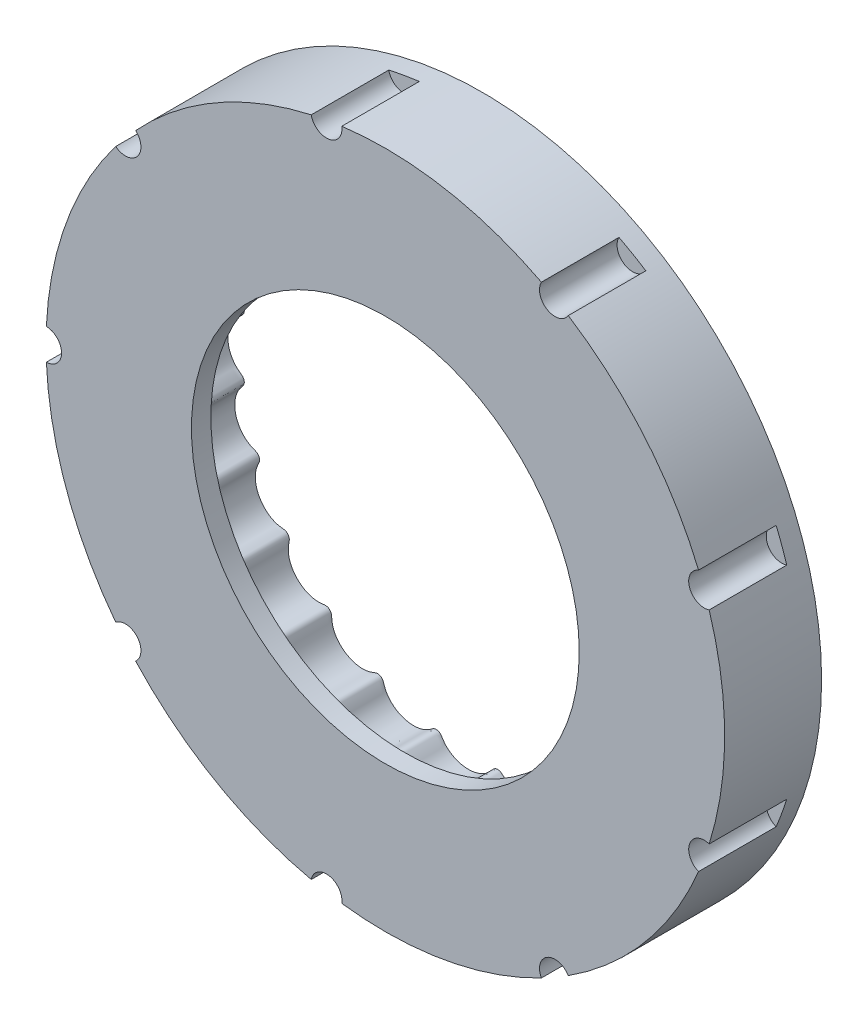
from build123d import *

# Parameters (mm, degrees)
ESQUISSE1_R             = 35
BOSS_EXTRU_1_DEPTH      = 8
ESQUISSE3_R             = 35
ESQUISSE3_R_2           = 20
BOSS_EXTRU_2_DEPTH      = 2
ESQUISSE4_R             = 1.6
ENL_V_MAT_EXTRU_2_DEPTH = 8


with BuildPart() as part:
    # Esquisse1 → Boss.-Extru.1 (new body)
    with BuildSketch(Plane.XY):
        Circle(ESQUISSE1_R)
        with BuildLine():
            add(Edge.make_bspline(
                [(24.75, 0), (24.75, -0.01190895), (24.750668659, -0.029768799), (24.75289752, -0.060006713), (24.758884934, -0.104774168), (24.767485304, -0.1467503), (24.785152354, -0.206071411), (24.818482478, -0.284185867), (24.880818803, -0.385919884), (24.984658612, -0.50047292), (25.114781066, -0.616600782), (25.255435339, -0.752464933), (25.419807145, -0.93333087), (25.594989864, -1.169106201), (25.768920192, -1.472936072), (25.920736133, -1.849650866), (26.023477253, -2.249860974), (26.074696747, -2.666946621), (26.073312156, -3.086313852), (26.020370658, -3.501501101), (25.917002683, -3.906273732), (25.764403676, -4.294347485), (25.566224565, -4.654785317), (25.325903213, -4.981499954), (25.081588671, -5.233067427), (24.851914535, -5.418631885), (24.667098284, -5.540217829), (24.539548747, -5.613941762), (24.410179088, -5.684594723), (24.273991814, -5.758046627), (24.120002912, -5.867762768), (23.989867, -6.050335584), (23.936355638, -6.275127193), (23.969192195, -6.495758333), (24.065351302, -6.684284012), (24.178449314, -6.851934675), (24.280144364, -7.019011908), (24.393570042, -7.235347013), (24.503436737, -7.50770452), (24.595094748, -7.84543671), (24.647032867, -8.248159789), (24.645694803, -8.661209862), (24.57595365, -9.185528563), (24.417645445, -9.696077248), (24.174741138, -10.176578568), (23.852030812, -10.610062282), (23.558837347, -10.90980476), (23.24095056, -11.157802847), (22.946586259, -11.329086722), (22.692113519, -11.440823192), (22.472657763, -11.513539342), (22.29388462, -11.561503733), (22.101259895, -11.606028638), (21.902055354, -11.681610724), (21.728453668, -11.828148656), (21.620885016, -12.038837081), (21.601595838, -12.263660858), (21.650481834, -12.469316746), (21.718254479, -12.659791435), (21.774584138, -12.84705718), (21.829677768, -13.084963879), (21.867201208, -13.376160202), (21.870688906, -13.725995236), (21.819474916, -14.128698884), (21.71419458, -14.527993453), (21.514773646, -15.017801417), (21.233133123, -15.4720736), (20.877140734, -15.876030958), (20.455657215, -16.214386724), (20.096354081, -16.430676116), (19.726170583, -16.590569736), (19.398076252, -16.68206281), (19.123633935, -16.725922166), (18.892914818, -16.74091163), (18.707848134, -16.742350192), (18.510091067, -16.737829569), (18.298399992, -16.764443666), (18.095471353, -16.866909122), (17.942147178, -17.047179332), (17.871387572, -17.261366287), (17.870202468, -17.472525416), (17.888313355, -17.673814374), (17.895669209, -17.869207586), (17.888886536, -18.113260777), (17.85168272, -18.404436203), (17.766823301, -18.743754438), (17.615819616, -19.120463832), (17.413434594, -19.48028858), (17.162321288, -19.816819375), (16.868500143, -20.122110223), (16.535786091, -20.390797243), (16.168397966, -20.617282366), (15.771042449, -20.795687849), (15.368766607, -20.914546396), (14.97017149, -20.975982916), (14.629556137, -20.981746846), (14.352921577, -20.954877105), (14.125857036, -20.911170138), (13.94640051, -20.866001244), (13.755772511, -20.812781493), (13.543469889, -20.788894817), (13.322238716, -20.84166807), (13.131407642, -20.981742865), (13.0130413, -21.173627181), (12.961818542, -21.378246364), (12.929064797, -21.57761534), (12.886990745, -21.768547341), (12.818791692, -22.002934942), (12.70930802, -22.275243379), (12.541628211, -22.582120244), (12.300626204, -22.908551746), (12.01422203, -23.205749325), (11.686582401, -23.4681837), (11.325453487, -23.689705246), (10.935854532, -23.866053147), (10.523258626, -23.992837457), (10.093696991, -24.06550579), (9.674368845, -24.079231972), (9.273085465, -24.038208914), (8.941983123, -23.957846351), (8.681067639, -23.861969077), (8.472360468, -23.762392874), (8.310008249, -23.673519219), (8.138322101, -23.574972467), (7.937182673, -23.501849574), (7.704899941, -23.502076627), (7.478095746, -23.600741865), (7.316947907, -23.77285878), (7.220831609, -23.97055906), (7.115634845, -24.203403783), (6.974300377, -24.460401189), (6.773045478, -24.737487424), (6.497851462, -25.02237666), (6.183428844, -25.270910892), (5.835740341, -25.479668636), (5.460328709, -25.645214949), (5.061542815, -25.765601822), (4.644666369, -25.83709061), (4.215744672, -25.855893135), (3.781608585, -25.818103671), (3.372294549, -25.725760832), (2.994169108, -25.584908149), (2.694109042, -25.423555897), (2.465647641, -25.264915254), (2.289085947, -25.115815571), (2.153739497, -24.989104422), (2.012318186, -24.851122457), (1.832423714, -24.733108156), (1.552983355, -24.66593755), (1.26214529, -24.754622086), (1.075414287, -24.957557798), (0.889090341, -25.194134228), (0.69672049, -25.401829912), (0.44758856, -25.61527269), (0.125683965, -25.821812182), (-0.224585626, -25.987068298), (-0.598975616, -26.109092558), (-0.990876156, -26.185347308), (-1.391941275, -26.2145582), (-1.796224618, -26.195837186), (-2.198144681, -26.128499562), (-2.591457519, -26.011923113), (-2.962803429, -25.848997421), (-3.306221845, -25.642423994), (-3.61537583, -25.39483403), (-3.850272783, -25.145621471), (-4.023133112, -24.908691884), (-4.156981332, -24.691054937), (-4.276293257, -24.506578487), (-4.456318725, -24.354528199), (-4.693068775, -24.282897531), (-4.923798246, -24.309710303), (-5.115035952, -24.406102337), (-5.273240645, -24.525178417), (-5.42301226, -24.633920894), (-5.617383402, -24.75923363), (-5.863981708, -24.887558689), (-6.182207181, -25.009385657), (-6.575059912, -25.101071531), (-6.9927825, -25.140689035), (-7.428136381, -25.123106217), (-7.851204623, -25.050059218), (-8.255644199, -24.926289526), (-8.635975215, -24.756290763), (-8.987390026, -24.544434268), (-9.305810055, -24.293211507), (-9.586131065, -24.006734367), (-9.822904508, -23.689158592), (-9.987239236, -23.388704672), (-10.094751199, -23.11580793), (-10.169610451, -22.871508954), (-10.24112571, -22.663502872), (-10.381175345, -22.473662137), (-10.594956363, -22.349311543), (-10.825624608, -22.322047042), (-11.033849204, -22.370890621), (-11.216381876, -22.447371753), (-11.388695767, -22.514940651), (-11.608352834, -22.58716666), (-11.87933894, -22.649041617), (-12.217942215, -22.68664221), (-12.621151131, -22.6763477), (-13.035301253, -22.609509201), (-13.452127793, -22.482943679), (-13.845292771, -22.304868342), (-14.20938889, -22.080540487), (-14.539531306, -21.814993299), (-14.831269767, -21.513076759), (-15.077661765, -21.181891436), (-15.275270226, -20.827454377), (-15.402577207, -20.501715906), (-15.476526159, -20.217667398), (-15.514326563, -19.976485954), (-15.531829272, -19.781749163), (-15.539202372, -19.579813227), (-15.565591069, -19.370421028), (-15.660806856, -19.1659885), (-15.83405536, -19.004717982), (-16.047591105, -18.926560558), (-16.261088064, -18.925182163), (-16.456798489, -18.954287053), (-16.640543184, -18.976331541), (-16.871307425, -18.990807395), (-17.149104778, -18.982241272), (-17.486194881, -18.933211709), (-17.873723074, -18.821638459), (-18.257615968, -18.652692803), (-18.629084532, -18.425342732), (-18.964764813, -18.15411038), (-19.260725449, -17.845401443), (-19.513475385, -17.50529118), (-19.719894943, -17.139574851), (-19.874988153, -16.756923442), (-19.976929286, -16.364037242), (-20.017953734, -16.016642642), (-20.017798024, -15.723070973), (-19.993447495, -15.480115157), (-19.96134753, -15.287225434), (-19.918054975, -15.089779832), (-19.89402871, -14.879875268), (-19.939362883, -14.658860507), (-20.070693635, -14.462043286), (-20.260249499, -14.336679591), (-20.467155514, -14.285214031), (-20.663881817, -14.2650629), (-20.847282484, -14.240161779), (-21.074211831, -14.195950386), (-21.340836688, -14.11751373), (-21.654611423, -13.985047804), (-22.001454707, -13.779432555), (-22.330360371, -13.519308084), (-22.705485211, -13.130240844), (-23.007369545, -12.684411231), (-23.229136266, -12.198075036), (-23.364819327, -11.686883469), (-23.418570267, -11.277399868), (-23.418213213, -10.871399708), (-23.370257339, -10.524800668), (-23.295965049, -10.240716159), (-23.211017087, -10.011726748), (-23.131365089, -9.833119484), (-23.040198426, -9.652618084), (-22.96715924, -9.454144986), (-22.960141523, -9.228680333), (-23.042373084, -9.007208297), (-23.198166311, -8.840665724), (-23.388940312, -8.741382585), (-23.57769294, -8.6722803), (-23.75308195, -8.599853942), (-23.966244513, -8.496298837), (-24.209343816, -8.347711506), (-24.48032477, -8.1355972), (-24.761295108, -7.846344695), (-25.008480075, -7.513349868), (-25.26655565, -7.04900195), (-25.442920247, -6.54763643), (-25.533949151, -6.025561479), (-25.536599067, -5.498854498), (-25.485486947, -5.088916426), (-25.382794666, -4.696000106), (-25.248906316, -4.372612425), (-25.105242941, -4.116427211), (-24.965170858, -3.916248887), (-24.843083512, -3.763442502), (-24.709834093, -3.611215538), (-24.591948067, -3.435387495), (-24.533798882, -3.220620895), (-24.560423715, -2.992589013), (-24.66665443, -2.797016304), (-24.822727104, -2.653701408), (-24.98966356, -2.53926073), (-25.146322188, -2.422077132), (-25.332496393, -2.263776399), (-25.502275925, -2.087254142), (-25.654526877, -1.895838833), (-25.79052351, -1.688263992), (-25.890012472, -1.511998867), (-25.978955887, -1.325507929), (-26.056614781, -1.131467198), (-26.121383307, -0.930707527), (-26.173241314, -0.729759288), (-26.207287779, -0.545661218), (-26.228372118, -0.39585777), (-26.240536879, -0.255725402), (-26.247025958, -0.16909655), (-26.249459241, -0.066739393), (-26.25, -0.022255367), (-26.25, 0)],
                knots=[0.07432085, 0.07432085, 0.07432085, 0.07432085, 0.07432085, 0.074838236, 0.075096929, 0.075355622, 0.075873009, 0.076390395, 0.077425167, 0.07845994, 0.080262761, 0.082065582, 0.083868403, 0.085671224, 0.089276866, 0.092882508, 0.096749545, 0.100616583, 0.104483621, 0.108350658, 0.112188336, 0.116026013, 0.11986369, 0.123701367, 0.12732655, 0.130951733, 0.132764324, 0.134576916, 0.135483211, 0.136389507, 0.138202099, 0.140295775, 0.142389451, 0.144458848, 0.146528245, 0.148330503, 0.150132762, 0.15193502, 0.153737278, 0.157341795, 0.160946311, 0.164812321, 0.16867833, 0.17254434, 0.180415799, 0.184421248, 0.188426697, 0.192432147, 0.195844027, 0.199255907, 0.200961848, 0.202667788, 0.204373728, 0.206079668, 0.208268892, 0.210458115, 0.21252702, 0.214595925, 0.216397713, 0.218199501, 0.220001289, 0.221803077, 0.225406654, 0.22901023, 0.232875219, 0.236740209, 0.240605199, 0.248476586, 0.252482983, 0.25648938, 0.260495777, 0.263907756, 0.267319735, 0.269025725, 0.270731714, 0.272437704, 0.274143693, 0.276335152, 0.278526612, 0.280594702, 0.282662792, 0.284464203, 0.286265613, 0.288067024, 0.289868435, 0.293471257, 0.297074079, 0.300938067, 0.304802055, 0.308666044, 0.312530032, 0.316537343, 0.320544653, 0.324551964, 0.328559274, 0.331971493, 0.335383713, 0.337089822, 0.338795932, 0.340502041, 0.342208151, 0.3444015, 0.346594848, 0.348661829, 0.35072881, 0.352529935, 0.354331061, 0.356132186, 0.357933311, 0.361535562, 0.365137813, 0.369000829, 0.372863844, 0.37672686, 0.380589876, 0.384598055, 0.388606234, 0.392614413, 0.396622592, 0.400035189, 0.403447785, 0.405154083, 0.406860381, 0.408566679, 0.410272977, 0.412467856, 0.414662735, 0.416905332, 0.41914793, 0.420947533, 0.422747136, 0.426346341, 0.429945547, 0.433544752, 0.437320979, 0.441097206, 0.444873433, 0.44864966, 0.452658654, 0.456667648, 0.460676642, 0.464685636, 0.468098738, 0.471511839, 0.473218389, 0.47492494, 0.476631491, 0.478338041, 0.480534086, 0.48273013, 0.487019518, 0.488748834, 0.49047815, 0.493936782, 0.497395414, 0.500854047, 0.504530334, 0.508206621, 0.511882908, 0.515559195, 0.519334982, 0.52311077, 0.526886557, 0.530662345, 0.534261527, 0.537860709, 0.541459892, 0.543259483, 0.545059074, 0.547300663, 0.549542252, 0.55173776, 0.553933267, 0.555639684, 0.5573461, 0.559052517, 0.560758933, 0.564171767, 0.5675846, 0.571593194, 0.575601788, 0.579610382, 0.583618976, 0.587395654, 0.591172332, 0.594949011, 0.598725689, 0.602324954, 0.605924219, 0.609523484, 0.611323117, 0.613122749, 0.615366313, 0.617609877, 0.619804036, 0.621998195, 0.623704391, 0.625410586, 0.627116782, 0.628822977, 0.632235368, 0.635647759, 0.63965551, 0.643663261, 0.647671012, 0.651678763, 0.655542261, 0.659405759, 0.663269257, 0.667132755, 0.670735268, 0.674337782, 0.676139039, 0.677940295, 0.679741552, 0.681542809, 0.683610379, 0.685677949, 0.687870397, 0.690062845, 0.691768886, 0.693474927, 0.695180968, 0.696887009, 0.700299091, 0.703711172, 0.707718031, 0.71172489, 0.715731748, 0.719738607, 0.723603093, 0.727467579, 0.731332066, 0.735196552, 0.738799727, 0.742402903, 0.744204491, 0.746006079, 0.747807667, 0.749609255, 0.751677791, 0.753746327, 0.755936711, 0.758127095, 0.75983305, 0.761539006, 0.763244962, 0.764950918, 0.76836283, 0.771774741, 0.775780668, 0.779786595, 0.783792522, 0.791663947, 0.795529445, 0.799394943, 0.803260441, 0.806864464, 0.810468487, 0.812270499, 0.81407251, 0.815874522, 0.817676533, 0.819745726, 0.821814919, 0.823998833, 0.826182748, 0.827931402, 0.829680057, 0.831428712, 0.833177366, 0.836674676, 0.840171985, 0.844093542, 0.8480151, 0.851936657, 0.859724738, 0.863591261, 0.867457784, 0.871324307, 0.874929364, 0.87853442, 0.880336948, 0.882139476, 0.883942004, 0.885744532, 0.887814048, 0.889883563, 0.891953048, 0.894022532, 0.895825669, 0.897628805, 0.899431941, 0.901235078, 0.90484135, 0.906644487, 0.908447623, 0.910381399, 0.912315175, 0.914248951, 0.916182727, 0.918116503, 0.920050278, 0.921017166, 0.921984054, 0.922950942, 0.92391783, 0.92391783, 0.92391783, 0.92391783, 0.92391783], degree=4))
            add(Edge.make_bspline(
                [(24.75, 0), (24.75, 0.01190895), (24.750668659, 0.029768799), (24.75289752, 0.060006713), (24.758884934, 0.104774168), (24.767485304, 0.1467503), (24.785152354, 0.206071411), (24.818482478, 0.284185867), (24.880818803, 0.385919884), (24.984658612, 0.50047292), (25.114781066, 0.616600782), (25.255435339, 0.752464933), (25.419807145, 0.93333087), (25.594989864, 1.169106201), (25.768920192, 1.472936072), (25.920736133, 1.849650866), (26.023477253, 2.249860974), (26.074696747, 2.666946621), (26.073312156, 3.086313852), (26.020370658, 3.501501101), (25.917002683, 3.906273732), (25.764403676, 4.294347485), (25.566224565, 4.654785317), (25.325903213, 4.981499954), (25.081588671, 5.233067427), (24.851914535, 5.418631885), (24.667098284, 5.540217829), (24.539548747, 5.613941762), (24.410179088, 5.684594723), (24.273991814, 5.758046627), (24.120002912, 5.867762768), (23.989867, 6.050335584), (23.936355638, 6.275127193), (23.969192195, 6.495758333), (24.065351302, 6.684284012), (24.178449314, 6.851934675), (24.280144364, 7.019011908), (24.393570042, 7.235347013), (24.503436737, 7.50770452), (24.595094748, 7.84543671), (24.647032867, 8.248159789), (24.645694803, 8.661209862), (24.57595365, 9.185528563), (24.417645445, 9.696077248), (24.174741138, 10.176578568), (23.852030812, 10.610062282), (23.558837347, 10.90980476), (23.24095056, 11.157802847), (22.946586259, 11.329086722), (22.692113519, 11.440823192), (22.472657763, 11.513539342), (22.29388462, 11.561503733), (22.101259895, 11.606028638), (21.902055354, 11.681610724), (21.728453668, 11.828148656), (21.620885016, 12.038837081), (21.601595838, 12.263660858), (21.650481834, 12.469316746), (21.718254479, 12.659791435), (21.774584138, 12.84705718), (21.829677768, 13.084963879), (21.867201208, 13.376160202), (21.870688906, 13.725995236), (21.819474916, 14.128698884), (21.71419458, 14.527993453), (21.514773646, 15.017801417), (21.233133123, 15.4720736), (20.877140734, 15.876030958), (20.455657215, 16.214386724), (20.096354081, 16.430676116), (19.726170583, 16.590569736), (19.398076252, 16.68206281), (19.123633935, 16.725922166), (18.892914818, 16.74091163), (18.707848134, 16.742350192), (18.510091067, 16.737829569), (18.298399992, 16.764443666), (18.095471353, 16.866909122), (17.942147178, 17.047179332), (17.871387572, 17.261366287), (17.870202468, 17.472525416), (17.888313355, 17.673814374), (17.895669209, 17.869207586), (17.888886536, 18.113260777), (17.85168272, 18.404436203), (17.766823301, 18.743754438), (17.615819616, 19.120463832), (17.413434594, 19.48028858), (17.162321288, 19.816819375), (16.868500143, 20.122110223), (16.535786091, 20.390797243), (16.168397966, 20.617282366), (15.771042449, 20.795687849), (15.368766607, 20.914546396), (14.97017149, 20.975982916), (14.629556137, 20.981746846), (14.352921577, 20.954877105), (14.125857036, 20.911170138), (13.94640051, 20.866001244), (13.755772511, 20.812781493), (13.543469889, 20.788894817), (13.322238716, 20.84166807), (13.131407642, 20.981742865), (13.0130413, 21.173627181), (12.961818542, 21.378246364), (12.929064797, 21.57761534), (12.886990745, 21.768547341), (12.818791692, 22.002934942), (12.70930802, 22.275243379), (12.541628211, 22.582120244), (12.300626204, 22.908551746), (12.01422203, 23.205749325), (11.686582401, 23.4681837), (11.325453487, 23.689705246), (10.935854532, 23.866053147), (10.523258626, 23.992837457), (10.093696991, 24.06550579), (9.674368845, 24.079231972), (9.273085465, 24.038208914), (8.941983123, 23.957846351), (8.681067639, 23.861969077), (8.472360468, 23.762392874), (8.310008249, 23.673519219), (8.138322101, 23.574972467), (7.937182673, 23.501849574), (7.704899941, 23.502076627), (7.478095746, 23.600741865), (7.316947907, 23.772858779), (7.220831609, 23.97055906), (7.115634845, 24.203403783), (6.974300377, 24.460401189), (6.773045477, 24.737487424), (6.497851462, 25.02237666), (6.183428844, 25.270910892), (5.835740341, 25.479668636), (5.460328709, 25.645214949), (5.061542815, 25.765601822), (4.644666369, 25.83709061), (4.215744672, 25.855893135), (3.781608585, 25.818103671), (3.372294549, 25.725760832), (2.994169108, 25.584908149), (2.694109042, 25.423555897), (2.465647641, 25.264915254), (2.289085947, 25.115815571), (2.153739497, 24.989104422), (2.012318186, 24.851122457), (1.832423714, 24.733108156), (1.552983354, 24.66593755), (1.26214529, 24.754622086), (1.075414287, 24.957557798), (0.889090341, 25.194134228), (0.69672049, 25.401829912), (0.44758856, 25.61527269), (0.125683965, 25.821812182), (-0.224585626, 25.987068298), (-0.598975616, 26.109092558), (-0.990876156, 26.185347308), (-1.391941275, 26.2145582), (-1.796224618, 26.195837186), (-2.198144681, 26.128499562), (-2.591457519, 26.011923113), (-2.962803429, 25.848997421), (-3.306221845, 25.642423994), (-3.61537583, 25.39483403), (-3.850272783, 25.145621471), (-4.023133112, 24.908691884), (-4.156981332, 24.691054937), (-4.276293257, 24.506578487), (-4.456318725, 24.354528199), (-4.693068775, 24.282897531), (-4.923798246, 24.309710303), (-5.115035952, 24.406102337), (-5.273240646, 24.525178417), (-5.42301226, 24.633920894), (-5.617383402, 24.75923363), (-5.863981708, 24.887558689), (-6.182207181, 25.009385657), (-6.575059912, 25.101071531), (-6.9927825, 25.140689035), (-7.428136381, 25.123106217), (-7.851204623, 25.050059218), (-8.255644199, 24.926289526), (-8.635975215, 24.756290763), (-8.987390026, 24.544434268), (-9.305810055, 24.293211507), (-9.586131065, 24.006734367), (-9.822904508, 23.689158592), (-9.987239236, 23.388704672), (-10.094751199, 23.11580793), (-10.169610451, 22.871508954), (-10.24112571, 22.663502872), (-10.381175345, 22.473662137), (-10.594956363, 22.349311543), (-10.825624608, 22.322047042), (-11.033849204, 22.370890621), (-11.216381876, 22.447371753), (-11.388695767, 22.514940651), (-11.608352834, 22.58716666), (-11.87933894, 22.649041617), (-12.217942215, 22.68664221), (-12.621151131, 22.676347699), (-13.035301253, 22.609509201), (-13.452127793, 22.482943679), (-13.845292771, 22.304868342), (-14.20938889, 22.080540487), (-14.539531306, 21.814993299), (-14.831269767, 21.513076759), (-15.077661765, 21.181891436), (-15.275270226, 20.827454377), (-15.402577207, 20.501715906), (-15.476526159, 20.217667398), (-15.514326563, 19.976485954), (-15.531829272, 19.781749163), (-15.539202372, 19.579813227), (-15.565591069, 19.370421028), (-15.660806856, 19.1659885), (-15.83405536, 19.004717982), (-16.047591105, 18.926560558), (-16.261088064, 18.925182163), (-16.456798489, 18.954287053), (-16.640543184, 18.976331541), (-16.871307425, 18.990807395), (-17.149104778, 18.982241272), (-17.486194881, 18.933211709), (-17.873723074, 18.821638459), (-18.257615968, 18.652692802), (-18.629084532, 18.425342732), (-18.964764813, 18.15411038), (-19.260725449, 17.845401443), (-19.513475385, 17.50529118), (-19.719894943, 17.139574851), (-19.874988153, 16.756923442), (-19.976929286, 16.364037242), (-20.017953734, 16.016642642), (-20.017798024, 15.723070973), (-19.993447495, 15.480115157), (-19.96134753, 15.287225434), (-19.918054975, 15.089779832), (-19.89402871, 14.879875268), (-19.939362883, 14.658860507), (-20.070693635, 14.462043286), (-20.260249499, 14.336679591), (-20.467155514, 14.285214031), (-20.663881817, 14.2650629), (-20.847282484, 14.240161779), (-21.074211831, 14.195950386), (-21.340836688, 14.11751373), (-21.654611423, 13.985047804), (-22.001454707, 13.779432555), (-22.330360371, 13.519308084), (-22.705485211, 13.130240844), (-23.007369545, 12.684411231), (-23.229136266, 12.198075036), (-23.364819327, 11.686883469), (-23.418570267, 11.277399868), (-23.418213213, 10.871399708), (-23.370257339, 10.524800667), (-23.295965049, 10.240716159), (-23.211017087, 10.011726748), (-23.131365089, 9.833119484), (-23.040198426, 9.652618084), (-22.96715924, 9.454144986), (-22.960141523, 9.228680333), (-23.042373084, 9.007208297), (-23.198166311, 8.840665724), (-23.388940312, 8.741382585), (-23.57769294, 8.6722803), (-23.75308195, 8.599853942), (-23.966244513, 8.496298837), (-24.209343816, 8.347711506), (-24.48032477, 8.1355972), (-24.761295108, 7.846344695), (-25.008480075, 7.513349868), (-25.26655565, 7.04900195), (-25.442920247, 6.54763643), (-25.533949151, 6.025561479), (-25.536599067, 5.498854498), (-25.485486947, 5.088916426), (-25.382794666, 4.696000106), (-25.248906316, 4.372612425), (-25.105242941, 4.116427211), (-24.965170858, 3.916248887), (-24.843083512, 3.763442502), (-24.709834093, 3.611215538), (-24.591948067, 3.435387495), (-24.533798882, 3.220620895), (-24.560423715, 2.992589013), (-24.66665443, 2.797016303), (-24.822727104, 2.653701408), (-24.98966356, 2.53926073), (-25.146322188, 2.422077132), (-25.332496393, 2.263776399), (-25.502275925, 2.087254142), (-25.654526877, 1.895838833), (-25.79052351, 1.688263992), (-25.890012472, 1.511998867), (-25.978955887, 1.325507929), (-26.056614781, 1.131467198), (-26.121383307, 0.930707527), (-26.173241314, 0.729759288), (-26.207287779, 0.545661218), (-26.228372118, 0.39585777), (-26.240536879, 0.255725402), (-26.247025958, 0.16909655), (-26.249459241, 0.066739393), (-26.25, 0.022255367), (-26.25, 0)],
                knots=[0.07432085, 0.07432085, 0.07432085, 0.07432085, 0.07432085, 0.074838236, 0.075096929, 0.075355622, 0.075873009, 0.076390395, 0.077425167, 0.07845994, 0.080262761, 0.082065582, 0.083868403, 0.085671224, 0.089276866, 0.092882508, 0.096749545, 0.100616583, 0.104483621, 0.108350658, 0.112188336, 0.116026013, 0.11986369, 0.123701367, 0.12732655, 0.130951733, 0.132764324, 0.134576916, 0.135483211, 0.136389507, 0.138202099, 0.140295775, 0.142389451, 0.144458848, 0.146528245, 0.148330503, 0.150132762, 0.15193502, 0.153737278, 0.157341795, 0.160946311, 0.164812321, 0.16867833, 0.17254434, 0.180415799, 0.184421248, 0.188426697, 0.192432147, 0.195844027, 0.199255907, 0.200961848, 0.202667788, 0.204373728, 0.206079668, 0.208268892, 0.210458115, 0.21252702, 0.214595925, 0.216397713, 0.218199501, 0.220001289, 0.221803077, 0.225406654, 0.22901023, 0.232875219, 0.236740209, 0.240605199, 0.248476586, 0.252482983, 0.25648938, 0.260495777, 0.263907756, 0.267319735, 0.269025725, 0.270731714, 0.272437704, 0.274143693, 0.276335152, 0.278526612, 0.280594702, 0.282662792, 0.284464203, 0.286265613, 0.288067024, 0.289868435, 0.293471257, 0.297074079, 0.300938067, 0.304802055, 0.308666044, 0.312530032, 0.316537343, 0.320544653, 0.324551964, 0.328559274, 0.331971493, 0.335383713, 0.337089822, 0.338795932, 0.340502041, 0.342208151, 0.3444015, 0.346594848, 0.348661829, 0.35072881, 0.352529935, 0.354331061, 0.356132186, 0.357933311, 0.361535562, 0.365137813, 0.369000829, 0.372863844, 0.37672686, 0.380589876, 0.384598055, 0.388606234, 0.392614413, 0.396622592, 0.400035189, 0.403447785, 0.405154083, 0.406860381, 0.408566679, 0.410272977, 0.412467856, 0.414662735, 0.416905332, 0.41914793, 0.420947533, 0.422747136, 0.426346341, 0.429945547, 0.433544752, 0.437320979, 0.441097206, 0.444873433, 0.44864966, 0.452658654, 0.456667648, 0.460676642, 0.464685636, 0.468098738, 0.471511839, 0.473218389, 0.47492494, 0.476631491, 0.478338041, 0.480534086, 0.48273013, 0.487019518, 0.488748834, 0.49047815, 0.493936782, 0.497395414, 0.500854047, 0.504530334, 0.508206621, 0.511882908, 0.515559195, 0.519334982, 0.52311077, 0.526886557, 0.530662345, 0.534261527, 0.537860709, 0.541459892, 0.543259483, 0.545059074, 0.547300663, 0.549542252, 0.55173776, 0.553933267, 0.555639684, 0.5573461, 0.559052517, 0.560758933, 0.564171767, 0.5675846, 0.571593194, 0.575601788, 0.579610382, 0.583618976, 0.587395654, 0.591172332, 0.594949011, 0.598725689, 0.602324954, 0.605924219, 0.609523484, 0.611323117, 0.613122749, 0.615366313, 0.617609877, 0.619804036, 0.621998195, 0.623704391, 0.625410586, 0.627116782, 0.628822977, 0.632235368, 0.635647759, 0.63965551, 0.643663261, 0.647671012, 0.651678763, 0.655542261, 0.659405759, 0.663269257, 0.667132755, 0.670735268, 0.674337782, 0.676139039, 0.677940295, 0.679741552, 0.681542809, 0.683610379, 0.685677949, 0.687870397, 0.690062845, 0.691768886, 0.693474927, 0.695180968, 0.696887009, 0.700299091, 0.703711172, 0.707718031, 0.71172489, 0.715731748, 0.719738607, 0.723603093, 0.727467579, 0.731332066, 0.735196552, 0.738799727, 0.742402903, 0.744204491, 0.746006079, 0.747807667, 0.749609255, 0.751677791, 0.753746327, 0.755936711, 0.758127095, 0.75983305, 0.761539006, 0.763244962, 0.764950918, 0.76836283, 0.771774741, 0.775780668, 0.779786595, 0.783792522, 0.791663947, 0.795529445, 0.799394943, 0.803260441, 0.806864464, 0.810468487, 0.812270499, 0.81407251, 0.815874522, 0.817676533, 0.819745726, 0.821814919, 0.823998833, 0.826182748, 0.827931402, 0.829680057, 0.831428712, 0.833177366, 0.836674676, 0.840171985, 0.844093542, 0.8480151, 0.851936657, 0.859724738, 0.863591261, 0.867457784, 0.871324307, 0.874929364, 0.87853442, 0.880336948, 0.882139476, 0.883942004, 0.885744532, 0.887814048, 0.889883563, 0.891953048, 0.894022532, 0.895825669, 0.897628805, 0.899431941, 0.901235078, 0.90484135, 0.906644487, 0.908447623, 0.910381399, 0.912315175, 0.914248951, 0.916182727, 0.918116503, 0.920050278, 0.921017166, 0.921984054, 0.922950942, 0.92391783, 0.92391783, 0.92391783, 0.92391783, 0.92391783], degree=4))
        make_face(mode=Mode.SUBTRACT)
    extrude(amount=BOSS_EXTRU_1_DEPTH)

    # Esquisse3 → Boss.-Extru.2 (add)
    with BuildSketch(Plane.XY.offset(8)):
        Circle(ESQUISSE3_R)
        Circle(ESQUISSE3_R_2, mode=Mode.SUBTRACT)
    extrude(amount=BOSS_EXTRU_2_DEPTH)

    # Esquisse4 → Enlèv. mat.-Extru.2 (cut)
    with BuildSketch(Plane.XY.offset(10)):
        with Locations((-35, 0)):
            Circle(ESQUISSE4_R)
        with Locations((-26.811555509, 22.497566339)):
            Circle(ESQUISSE4_R)
        with Locations((-6.077686218, 34.468271355)):
            Circle(ESQUISSE4_R)
        with Locations((17.5, 30.310889132)):
            Circle(ESQUISSE4_R)
        with Locations((32.889241728, 11.970705016)):
            Circle(ESQUISSE4_R)
        with Locations((32.889241728, -11.970705016)):
            Circle(ESQUISSE4_R)
        with Locations((17.5, -30.310889132)):
            Circle(ESQUISSE4_R)
        with Locations((-6.077686218, -34.468271355)):
            Circle(ESQUISSE4_R)
        with Locations((-26.811555509, -22.497566339)):
            Circle(ESQUISSE4_R)
    extrude(amount=-ENL_V_MAT_EXTRU_2_DEPTH, mode=Mode.SUBTRACT)


solid = part.part
